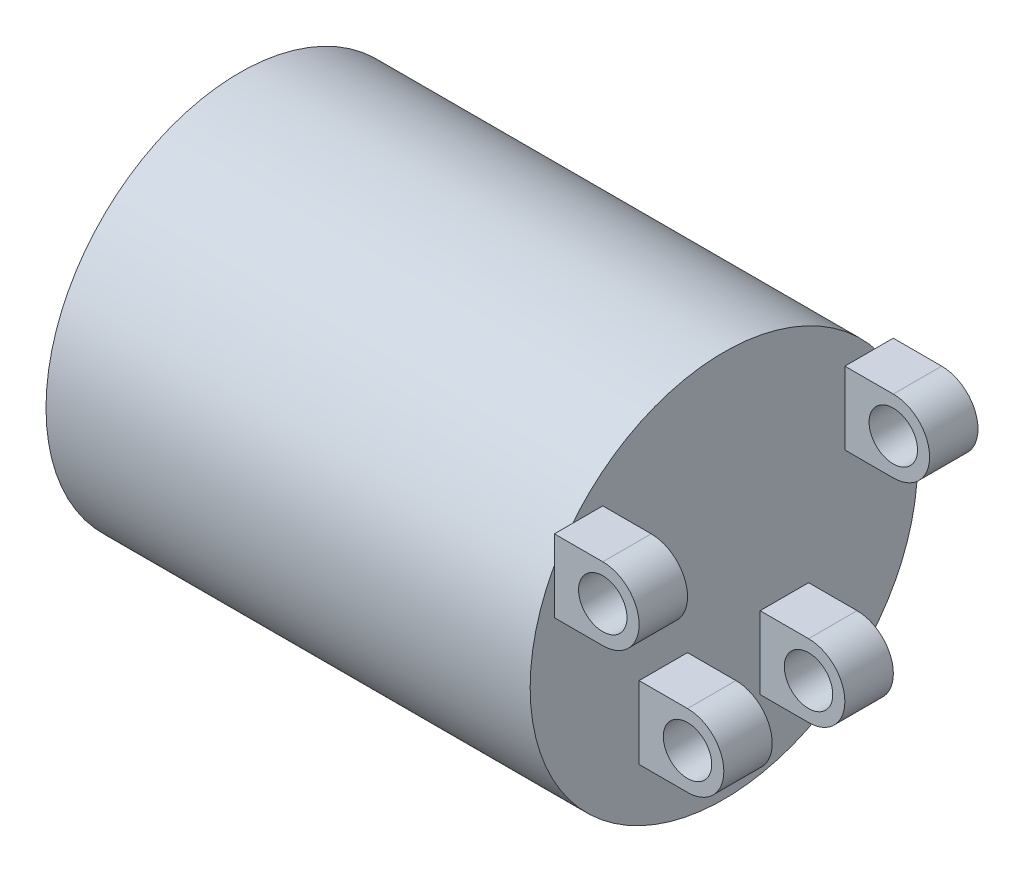
from build123d import *

# Parameters (mm, degrees)
EXTRUDE_1_DEPTH          = 50
EXTRUDE_1_DEPTH_BACK     = 50
SKETCH_1_R               = 40
SKETCH_2_W               = 10
SKETCH_2_H               = 15
EXTRUDE_2_DEPTH          = 10
EXTRUDE_2_2_DEPTH        = 10
EXTRUDE_2_3_DEPTH        = 10
SKETCH_2_W_2             = 10.018528149
EXTRUDE_2_4_DEPTH        = 10
SKETCH_4_W               = 10
SKETCH_4_H               = 7.5
SKETCH_5_W               = 10
SKETCH_5_H               = 7.5
SKETCH_6_W               = 10
SKETCH_6_H               = 7.5
SKETCH_7_W               = 10.018528149
SKETCH_7_H               = 7.5
CUT_EXTRUDE_1_DEPTH      = 109.54146673
CUT_EXTRUDE_1_DEPTH_BACK = 109.54146673
SKETCH_9_R               = 5
CUT_EXTRUDE_2_DEPTH      = 98.275382292
CUT_EXTRUDE_2_DEPTH_BACK = 98.275382292
SKETCH_10_R              = 5


with BuildPart() as part:
    # 草图1 → 凸台-拉伸1 (new, two sides: drawn at the far end of the back side and taken through both)
    with BuildSketch(Plane(origin=(0, 0, 0), x_dir=(0, 0, -1), z_dir=(1, 0, 0)).offset(-EXTRUDE_1_DEPTH_BACK)):
        Circle(SKETCH_1_R)
    extrude(amount=EXTRUDE_1_DEPTH + EXTRUDE_1_DEPTH_BACK)


with BuildPart() as body_2:
    # 草图2 → 凸台-拉伸2 (new body)
    with BuildSketch(Plane(origin=(50, 0, 0), x_dir=(0, 0, -1), z_dir=(1, 0, 0))):
        with Locations((-30, 17.5)):
            Rectangle(SKETCH_2_W, SKETCH_2_H)
    extrude(amount=EXTRUDE_2_DEPTH)

    # 草图4 → 旋转1 (revolve)
    with BuildSketch(Plane(origin=(60, 0, 0), x_dir=(0, 0, -1), z_dir=(1, 0, 0))):
        with Locations((-30, 21.25)):
            Rectangle(SKETCH_4_W, SKETCH_4_H)
    revolve(axis=Axis((60, 17.5, 35), (0, 0, -1)))


with BuildPart() as body_3:
    # 草图2 → Extrude 2 2 (new body)
    with BuildSketch(Plane(origin=(50, 0, 0), x_dir=(0, 0, -1), z_dir=(1, 0, 0))):
        with Locations((30, 17.5)):
            Rectangle(SKETCH_2_W, SKETCH_2_H)
    extrude(amount=EXTRUDE_2_2_DEPTH)

    # 草图5 → 旋转2 (revolve)
    with BuildSketch(Plane(origin=(60, 0, 0), x_dir=(0, 0, -1), z_dir=(1, 0, 0))):
        with Locations((30, 21.25)):
            Rectangle(SKETCH_5_W, SKETCH_5_H)
    revolve(axis=Axis((60, 17.5, -25), (0, 0, -1)))


with BuildPart() as body_4:
    # 草图2 → Extrude 2 3 (new body)
    with BuildSketch(Plane(origin=(50, 0, 0), x_dir=(0, 0, -1), z_dir=(1, 0, 0))):
        with Locations((-12.5, -17.5)):
            Rectangle(SKETCH_2_W, SKETCH_2_H)
    extrude(amount=EXTRUDE_2_3_DEPTH)

    # 草图6 → 旋转3 (revolve)
    with BuildSketch(Plane(origin=(60, 0, 0), x_dir=(0, 0, -1), z_dir=(1, 0, 0))):
        with Locations((-12.5, -13.75)):
            Rectangle(SKETCH_6_W, SKETCH_6_H)
    revolve(axis=Axis((60, -17.5, 17.5), (0, 0, -1)))


with BuildPart() as body_5:
    # 草图2 → Extrude 2 4 (new body)
    with BuildSketch(Plane(origin=(50, 0, 0), x_dir=(0, 0, -1), z_dir=(1, 0, 0))):
        with Locations((12.509264075, -17.5)):
            Rectangle(SKETCH_2_W_2, SKETCH_2_H)
    extrude(amount=EXTRUDE_2_4_DEPTH)

    # 草图7 → 旋转4 (revolve)
    with BuildSketch(Plane(origin=(60, 0, 0), x_dir=(0, 0, -1), z_dir=(1, 0, 0))):
        with Locations((12.509264075, -13.75)):
            Rectangle(SKETCH_7_W, SKETCH_7_H)
    revolve(axis=Axis((60, -17.5, -7.5), (0, 0, -1)))


with BuildPart() as cut_extrude_1_tool:
    # 草图9 → 切除-拉伸1 (new, two sides: drawn at the far end of the back side and taken through both)
    with BuildSketch(Plane.XY.offset(35).offset(-CUT_EXTRUDE_1_DEPTH_BACK)):
        with Locations((60, 17.5)):
            Circle(SKETCH_9_R)
    extrude(amount=CUT_EXTRUDE_1_DEPTH + CUT_EXTRUDE_1_DEPTH_BACK)


with BuildPart() as body_2_1:
    add(body_2.part)

    # 切除-拉伸1: cut by cut_extrude_1_tool
    add(cut_extrude_1_tool.part, mode=Mode.SUBTRACT)


with BuildPart() as body_3_1:
    add(body_3.part)

    # 切除-拉伸1: cut by cut_extrude_1_tool
    add(cut_extrude_1_tool.part, mode=Mode.SUBTRACT)


with BuildPart() as cut_extrude_2_tool:
    # 草图10 → 切除-拉伸2 (new, two sides: drawn at the far end of the back side and taken through both)
    with BuildSketch(Plane.XY.offset(17.5).offset(-CUT_EXTRUDE_2_DEPTH_BACK)):
        with Locations((60, -17.5)):
            Circle(SKETCH_10_R)
    extrude(amount=CUT_EXTRUDE_2_DEPTH + CUT_EXTRUDE_2_DEPTH_BACK)


with BuildPart() as body_4_1:
    add(body_4.part)

    # 切除-拉伸2: cut by cut_extrude_2_tool
    add(cut_extrude_2_tool.part, mode=Mode.SUBTRACT)


with BuildPart() as body_5_1:
    add(body_5.part)

    # 切除-拉伸2: cut by cut_extrude_2_tool
    add(cut_extrude_2_tool.part, mode=Mode.SUBTRACT)


solid = Compound([part.part, body_2_1.part, body_3_1.part, body_4_1.part, body_5_1.part])
